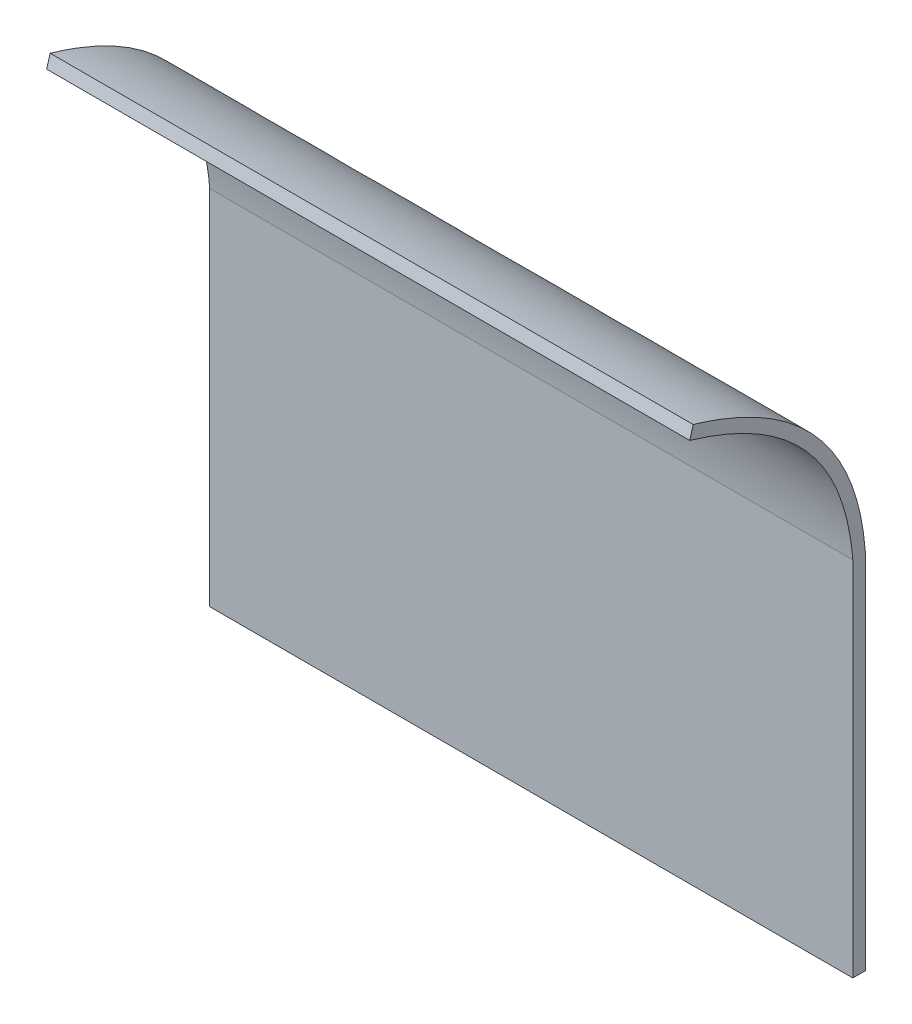
from build123d import *

# Parameters (mm, degrees)
BOSS_EXTRU_1_DEPTH = 102.5


with BuildPart() as part:
    # Esquisse2 → Boss.-Extru.1 (new body)
    with BuildSketch(Plane(origin=(0, 0, 0), x_dir=(0, 0, -1), z_dir=(1, 0, 0))):
        with BuildLine():
            Line((20.175844181, 57.796560731), (20.175844181, 0))
            Line((20.175844181, 0), (18.175844181, 0))
            Line((18.175844181, 0), (18.175844181, 57.719847418))
            add(Edge.make_bspline(
                [(-7.816037555, 87.197675328), (1.458199142, 84.486674845), (11.235554116, 76.513419425), (17.493683513, 66.237213452), (18.175844181, 57.719847418)],
                knots=[0.581934289, 0.581934289, 0.581934289, 0.73870893, 0.843225358, 1, 1, 1], degree=2))
            Line((-7.816037555, 87.197675328), (-7.259494569, 89.118680248))
            add(Edge.make_bspline(
                [(20.175844181, 57.796560731), (18.360004181, 81.6963399), (-7.259494569, 89.118680248)],
                knots=[0.58124873, 0.58124873, 0.58124873, 1, 1, 1], degree=2))
        make_face()
    extrude(amount=BOSS_EXTRU_1_DEPTH)


solid = part.part
